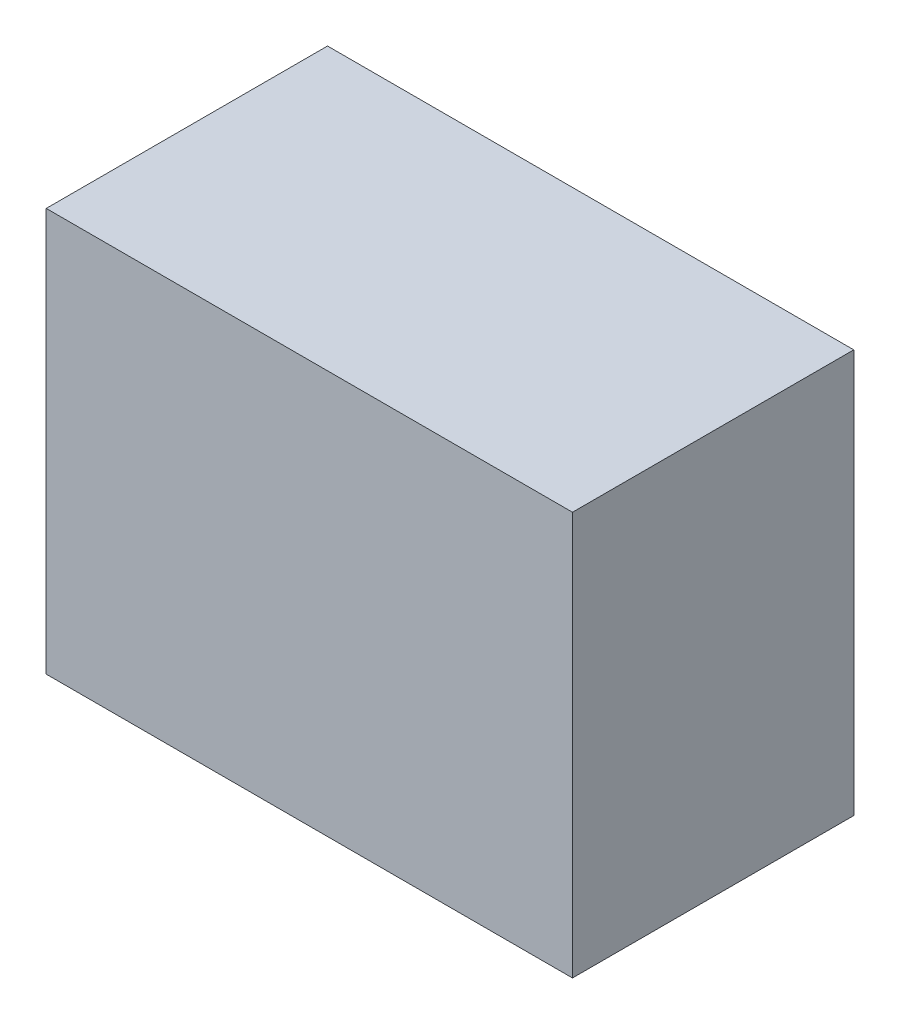
from build123d import *

# Parameters (mm, degrees)
SKETCH1_W           = 98.5
SKETCH1_H           = 75.5
BOSS_EXTRUDE1_DEPTH = 52.65
SKETCH2_R           = 3.4
CUT_EXTRUDE1_DEPTH  = 6.35


with BuildPart() as part:
    # Sketch1 → Boss-Extrude1 (new body)
    with BuildSketch(Plane.XY):
        Rectangle(SKETCH1_W, SKETCH1_H)
    extrude(amount=BOSS_EXTRUDE1_DEPTH)

    # Sketch2 → Cut-Extrude1 (cut)
    with BuildSketch(Plane(origin=(0, 0, 0), x_dir=(-1, 0, 0), z_dir=(0, 0, -1))):
        with Locations((-41.5, 30)):
            Circle(SKETCH2_R)
        with Locations((-41.5, -30)):
            Circle(SKETCH2_R)
        with Locations((41.5, 30)):
            Circle(SKETCH2_R)
        with Locations((41.5, -30)):
            Circle(SKETCH2_R)
    extrude(amount=-CUT_EXTRUDE1_DEPTH, mode=Mode.SUBTRACT)


solid = part.part
